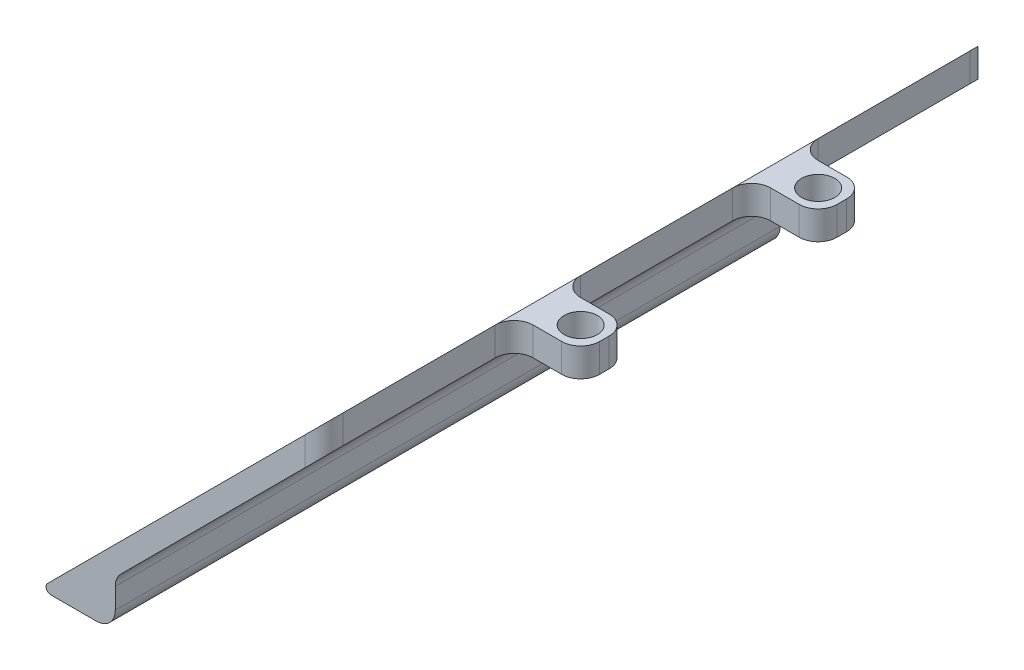
from build123d import *

# Parameters (mm, degrees)
SKETCH_1_W          = 7
SKETCH_1_H          = 3
EXTRUDE_1_DEPTH     = 70
SKETCH_2_R          = 1.75
CUT_EXTRUDE_1_DEPTH = 70
SKETCH_3_W          = 7
SKETCH_3_H          = 20
CUT_EXTRUDE_2_DEPTH = 70
FILLET_1_R          = 2
FILLET_3_R          = 2
FILLET_4_R          = 2
FILLET_5_R          = 2
SKETCH_4_W          = 20
SKETCH_4_H          = 3
CUT_EXTRUDE_3_DEPTH = 7
FILLET_6_R          = 2
FILLET_7_R          = 0.5
SKETCH_5_W          = 53
SKETCH_5_H          = 18.5
CUT_EXTRUDE_4_DEPTH = 8
SKETCH_7_R          = 1.75
EXTRUDE_3_DEPTH     = 2.121320344
FILLET_9_R          = 1


with BuildPart() as part:
    # 草图1 → 凸台-拉伸1 (new body)
    with BuildSketch(Plane.XY):
        with Locations((44.266038526, 33.998202963)):
            Rectangle(SKETCH_1_W, SKETCH_1_H)
        Polygon((40.766038526, 32.498202963), (40.766038526, 35.498202963), (10.766038526, 5.498202963), (13.766038526, 5.498202963), (18.766038526, 10.498202963), align=None)
        Polygon((18.766038526, 5.498202963), (18.766038526, 10.498202963), (13.766038526, 5.498202963), align=None)
    extrude(amount=EXTRUDE_1_DEPTH)

    # 草图2 → 切除-拉伸1 (cut)
    with BuildSketch(Plane(origin=(0, 35.498202963, 0), x_dir=(1, 0, 0), z_dir=(0, 1, 0))):
        with Locations(Location((45.266038526, -22.5, 0), (0, 0, 270))):
            Circle(SKETCH_2_R)
        with Locations(Location((45.266038526, -47.5, 0), (0, 0, 270))):
            Circle(SKETCH_2_R)
    extrude(amount=-CUT_EXTRUDE_1_DEPTH, mode=Mode.SUBTRACT)

    # 草图3 → 切除-拉伸2 (cut)
    with BuildSketch(Plane(origin=(0, 35.498202963, 0), x_dir=(1, 0, 0), z_dir=(0, 1, 0))):
        with Locations((44.266038526, -10)):
            Rectangle(SKETCH_3_W, SKETCH_3_H)
        with Locations((44.266038526, -60)):
            Rectangle(SKETCH_3_W, SKETCH_3_H)
    extrude(amount=-CUT_EXTRUDE_2_DEPTH, mode=Mode.SUBTRACT)

    # 圆角1
    fillet_1_edges = [part.edges().sort_by_distance(p)[0] for p in [
        (40.766038526, 33.998202963, 20),
        (40.766038526, 33.998202963, 50),
    ]]
    fillet(fillet_1_edges, radius=FILLET_1_R)

    # 圆角3
    fillet_3_edges = [part.edges().sort_by_distance(p)[0] for p in [
        (40.766038526, 33.998202963, 0),
        (40.766038526, 33.998202963, 70),
    ]]
    fillet(fillet_3_edges, radius=FILLET_3_R)

    # 圆角4
    fillet_4_edges = [part.edges().sort_by_distance(p)[0] for p in [
        (18.766038526, 10.498202963, 35),
        (18.766038526, 5.498202963, 35),
    ]]
    fillet(fillet_4_edges, radius=FILLET_4_R)

    # 圆角5
    fillet_5_edges = [part.edges().sort_by_distance(p)[0] for p in [
        (47.766038526, 33.998202963, 20),
        (47.766038526, 33.998202963, 50),
    ]]
    fillet(fillet_5_edges, radius=FILLET_5_R)

    # 草图4 → 切除-拉伸3 (cut)
    with BuildSketch(Plane(origin=(47.766038526, 0, 0), x_dir=(0, 0, -1), z_dir=(1, 0, 0))):
        with Locations((-35, 33.998202963)):
            Rectangle(SKETCH_4_W, SKETCH_4_H)
    extrude(amount=-CUT_EXTRUDE_3_DEPTH, mode=Mode.SUBTRACT)

    # 圆角6
    fillet_6_edges = [part.edges().sort_by_distance(p)[0] for p in [
        (40.766038526, 33.998202963, 45),
        (40.766038526, 33.998202963, 25),
        (47.766038526, 33.998202963, 45),
        (47.766038526, 33.998202963, 25),
    ]]
    fillet(fillet_6_edges, radius=FILLET_6_R)

    # 圆角7
    fillet_7_edges = [part.edges().sort_by_distance(p)[0] for p in [
        (10.766038526, 5.498202963, 35),
    ]]
    fillet(fillet_7_edges, radius=FILLET_7_R)

    # 草图5 → 切除-拉伸4 (cut)
    with BuildSketch(Plane(origin=(2.633917782, -2.633917782, 0), x_dir=(0, 0, 1), z_dir=(-0.7071067811865477, 0.7071067811865475, 0))):
        with Locations((35, 34.676962319)):
            Rectangle(SKETCH_5_W, SKETCH_5_H)
    extrude(amount=-CUT_EXTRUDE_4_DEPTH, mode=Mode.SUBTRACT)

    # 草图7 → 凸台-拉伸3 (add)
    # profile 1 of 2: a face of its own
    with BuildSketch(Plane(origin=(2.633917782, -2.633917782, 0), x_dir=(0, 0, 1), z_dir=(-0.7071067811865477, 0.7071067811865475, 0))):
        Polygon((13.25, 39.176962319), (15.5, 39.176962319), (15.5, 30.176962319), (13.25, 30.176962319), (13.25, 25.426962319), (8.5, 25.426962319), (8.5, 43.926962319), (13.25, 43.926962319), align=None)
        with Locations(Location((12.5, 34.676962319, 0), (0, 0, 270))):
            Circle(SKETCH_7_R, mode=Mode.SUBTRACT)
    # profile 2 of 2: a face of its own
    with BuildSketch(Plane(origin=(2.633917782, -2.633917782, 0), x_dir=(0, 0, 1), z_dir=(-0.7071067811865477, 0.7071067811865475, 0))):
        Polygon((56.75, 30.176962319), (54.5, 30.176962319), (54.5, 39.176962319), (56.75, 39.176962319), (56.75, 43.926962319), (61.5, 43.926962319), (61.5, 35.176962319), (61.5, 25.426962319), (56.75, 25.426962319), align=None)
        with Locations(Location((57.5, 34.676962319, 0), (0, 0, 270))):
            Circle(SKETCH_7_R, mode=Mode.SUBTRACT)
    extrude(amount=-EXTRUDE_3_DEPTH)

    # 圆角9
    fillet_9_edges = [part.edges().sort_by_distance(p)[0] for p in [
        (34.444970714, 27.677135151, 13.25),
        (31.086213504, 24.31837794, 13.25),
        (31.086213504, 24.31837794, 15.5),
        (24.722252473, 17.954416909, 15.5),
        (24.722252473, 17.954416909, 13.25),
        (21.363495262, 14.595659699, 13.25),
        (21.363495262, 14.595659699, 56.75),
        (24.722252473, 17.954416909, 56.75),
        (24.722252473, 17.954416909, 54.5),
        (31.086213504, 24.31837794, 54.5),
        (31.086213504, 24.31837794, 56.75),
        (34.444970714, 27.677135151, 56.75),
    ]]
    fillet(fillet_9_edges, radius=FILLET_9_R)


solid = part.part
